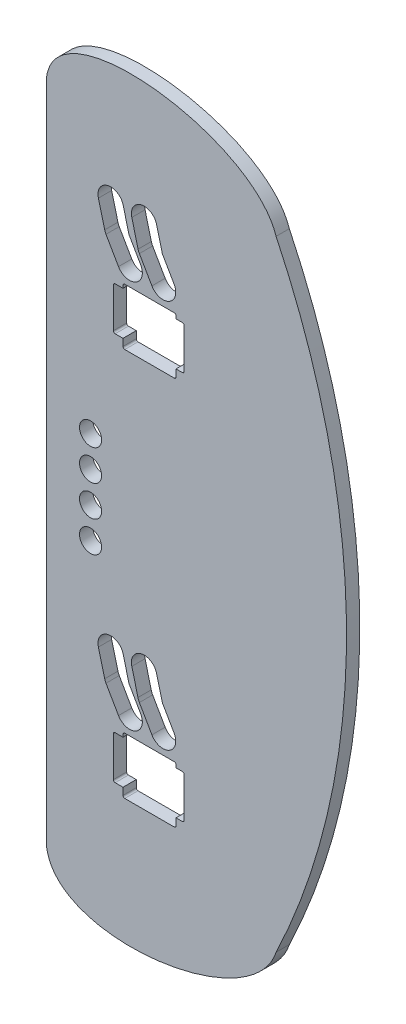
from build123d import *

# Parameters (mm, degrees)
SKETCH19_R          = 15.875
BOSS_EXTRUDE2_DEPTH = 19.05


with BuildPart() as part:
    # Sketch19 → Boss-Extrude2 (new body)
    with BuildSketch(Plane.XY):
        with BuildLine():
            add(Edge.make_bspline(
                [(1691.296561672, 1918.177904127), (1656.762851887, 2023.18607917), (1371.325091688, 2058.930160841), (1361.096561672, 1948.863494174)],
                knots=[0, 0, 0, 0, 7.638294788, 7.638294788, 7.638294788, 7.638294788], degree=3))
            Line((1361.096561672, 1948.863494174), (1361.096561672, 996.363494174))
            add(Edge.make_bspline(
                [(1691.296561672, 1027.049084222), (1656.707719979, 922.059056278), (1371.325091688, 886.296827508), (1361.096561672, 996.363494174)],
                knots=[0, 0, 0, 0, 7.629784399, 7.629784399, 7.629784399, 7.629784399], degree=3))
            ThreePointArc((1691.296561672, 1027.049084222), (1792.519416014, 1472.613494174), (1691.296561672, 1918.177904127))
        make_face()
        with BuildLine():
            Line((1556.504865632, 1122.44241392), (1547.43077252, 1122.44241392))
            Line((1547.43077252, 1122.44241392), (1547.43077252, 1112.28241392))
            ThreePointArc((1547.43077252, 1112.28241392), (1546.686823744, 1110.486362696), (1544.89077252, 1109.74241392))
            Line((1544.89077252, 1109.74241392), (1473.77077252, 1109.74241392))
            ThreePointArc((1473.77077252, 1109.74241392), (1471.974721296, 1110.486362696), (1471.23077252, 1112.28241392))
            Line((1471.23077252, 1112.28241392), (1471.23077252, 1122.44241392))
            Line((1471.23077252, 1122.44241392), (1459.984865632, 1122.44241392))
            ThreePointArc((1459.984865632, 1122.44241392), (1458.188814408, 1123.186362696), (1457.444865632, 1124.98241392))
            Line((1457.444865632, 1124.98241392), (1457.444865632, 1182.13241392))
            ThreePointArc((1457.444865632, 1182.13241392), (1458.188814408, 1183.928465145), (1459.984865632, 1184.67241392))
            Line((1459.984865632, 1184.67241392), (1471.23077252, 1184.67241392))
            Line((1471.23077252, 1184.67241392), (1471.23077252, 1188.48241392))
            ThreePointArc((1471.23077252, 1188.48241392), (1471.974721296, 1190.278465145), (1473.77077252, 1191.02241392))
            Line((1473.77077252, 1191.02241392), (1544.89077252, 1191.02241392))
            ThreePointArc((1544.89077252, 1191.02241392), (1546.686823744, 1190.278465145), (1547.43077252, 1188.48241392))
            Line((1547.43077252, 1188.48241392), (1547.43077252, 1184.67241392))
            Line((1547.43077252, 1184.67241392), (1556.504865632, 1184.67241392))
            ThreePointArc((1556.504865632, 1184.67241392), (1558.300916856, 1183.928465145), (1559.044865632, 1182.13241392))
            Line((1559.044865632, 1182.13241392), (1559.044865632, 1124.98241392))
            ThreePointArc((1559.044865632, 1124.98241392), (1558.300916856, 1123.186362696), (1556.504865632, 1122.44241392))
        make_face(mode=Mode.SUBTRACT)
        with BuildLine():
            Line((1444.893065071, 1244.244623225), (1435.893057671, 1279.244553225))
            ThreePointArc((1435.893057671, 1279.244553225), (1449.094985702, 1301.58631231), (1471.436744787, 1288.384384279))
            Line((1471.436744787, 1288.384384279), (1479.734522372, 1256.115340295))
            ThreePointArc((1479.734522372, 1256.115340295), (1479.841246759, 1255.791962976), (1479.990269115, 1255.485768066))
            Line((1479.990269115, 1255.485768066), (1495.595800102, 1228.231937145))
            ThreePointArc((1495.595800102, 1228.231937145), (1496.589194493, 1226.682766417), (1497.422422708, 1225.041884612))
            ThreePointArc((1497.422422708, 1225.041884612), (1488.994111708, 1201.213784587), (1464.764130707, 1208.40564094))
            Line((1464.764130707, 1208.40564094), (1446.764069078, 1239.655616711))
            ThreePointArc((1446.764069078, 1239.655616711), (1445.672935755, 1241.886666839), (1444.893065071, 1244.244623225))
        make_face(mode=Mode.SUBTRACT)
        with Locations(Location((1424.596561672, 1405.938494174, 0), (0, 0, 180))):
            Circle(SKETCH19_R, mode=Mode.SUBTRACT)
        with Locations(Location((1424.596561672, 1450.388494174, 0), (0, 0, 180))):
            Circle(SKETCH19_R, mode=Mode.SUBTRACT)
        with BuildLine():
            Line((1527.986726026, 1255.506514787), (1544.56575997, 1226.723451874))
            ThreePointArc((1544.56575997, 1226.723451874), (1537.823790218, 1201.663704337), (1512.764042681, 1208.405674089))
            Line((1512.764042681, 1208.405674089), (1494.764045881, 1239.655687936))
            ThreePointArc((1494.764045881, 1239.655687936), (1493.802589185, 1241.576837352), (1493.072252129, 1243.597189262))
            ThreePointArc((1493.072252129, 1243.597189262), (1492.894588833, 1244.238723731), (1492.740311476, 1244.886280075))
            Line((1492.740311476, 1244.886280075), (1483.894581433, 1279.238653731))
            ThreePointArc((1483.894581433, 1279.238653731), (1497.09201275, 1301.585586702), (1519.436740684, 1288.384422355))
            Line((1519.436740684, 1288.384422355), (1527.727745028, 1256.141718681))
            ThreePointArc((1527.727745028, 1256.141718681), (1527.835693423, 1255.815333734), (1527.986726026, 1255.506514787))
        make_face(mode=Mode.SUBTRACT)
        with Locations(Location((1424.596561672, 1494.838494174, 0), (0, 0, 180))):
            Circle(SKETCH19_R, mode=Mode.SUBTRACT)
        with Locations(Location((1424.596561672, 1539.288494174, 0), (0, 0, 180))):
            Circle(SKETCH19_R, mode=Mode.SUBTRACT)
        with BuildLine():
            Line((1547.43077252, 1681.24241392), (1547.43077252, 1671.08241392))
            ThreePointArc((1547.43077252, 1671.08241392), (1546.686823744, 1669.286362696), (1544.89077252, 1668.54241392))
            Line((1544.89077252, 1668.54241392), (1473.77077252, 1668.54241392))
            ThreePointArc((1473.77077252, 1668.54241392), (1471.974721296, 1669.286362696), (1471.23077252, 1671.08241392))
            Line((1471.23077252, 1671.08241392), (1471.23077252, 1681.24241392))
            Line((1471.23077252, 1681.24241392), (1459.984865632, 1681.24241392))
            ThreePointArc((1459.984865632, 1681.24241392), (1458.188814408, 1681.986362696), (1457.444865632, 1683.78241392))
            Line((1457.444865632, 1683.78241392), (1457.444865632, 1740.93241392))
            ThreePointArc((1457.444865632, 1740.93241392), (1458.188814408, 1742.728465145), (1459.984865632, 1743.47241392))
            Line((1459.984865632, 1743.47241392), (1471.23077252, 1743.47241392))
            Line((1471.23077252, 1743.47241392), (1471.23077252, 1747.28241392))
            ThreePointArc((1471.23077252, 1747.28241392), (1471.974721296, 1749.078465145), (1473.77077252, 1749.82241392))
            Line((1473.77077252, 1749.82241392), (1544.89077252, 1749.82241392))
            ThreePointArc((1544.89077252, 1749.82241392), (1546.686823744, 1749.078465145), (1547.43077252, 1747.28241392))
            Line((1547.43077252, 1747.28241392), (1547.43077252, 1743.47241392))
            Line((1547.43077252, 1743.47241392), (1556.504865632, 1743.47241392))
            ThreePointArc((1556.504865632, 1743.47241392), (1558.300916856, 1742.728465145), (1559.044865632, 1740.93241392))
            Line((1559.044865632, 1740.93241392), (1559.044865632, 1683.78241392))
            ThreePointArc((1559.044865632, 1683.78241392), (1558.300916856, 1681.986362696), (1556.504865632, 1681.24241392))
            Line((1556.504865632, 1681.24241392), (1547.43077252, 1681.24241392))
        make_face(mode=Mode.SUBTRACT)
        with BuildLine():
            Line((1444.893131568, 1803.044661302), (1435.893124168, 1838.044591302))
            ThreePointArc((1435.893124168, 1838.044591302), (1449.095052199, 1860.386350386), (1471.436811284, 1847.184422355))
            Line((1471.436811284, 1847.184422355), (1479.727821657, 1814.941695236))
            ThreePointArc((1479.727821657, 1814.941695236), (1479.835768961, 1814.615312965), (1479.98679977, 1814.30649635))
            Line((1479.98679977, 1814.30649635), (1496.565772911, 1785.52338757))
            ThreePointArc((1496.565772911, 1785.52338757), (1489.823779303, 1760.463721825), (1464.764105889, 1767.205686923))
            Line((1464.764105889, 1767.205686923), (1446.764116481, 1798.455687936))
            ThreePointArc((1446.764116481, 1798.455687936), (1445.672995031, 1800.686722627), (1444.893131568, 1803.044661302))
        make_face(mode=Mode.SUBTRACT)
        with BuildLine():
            Line((1492.893060968, 1803.044661302), (1483.893053568, 1838.044591302))
            ThreePointArc((1483.893053568, 1838.044591302), (1497.094981599, 1860.386350386), (1519.436740684, 1847.184422355))
            Line((1519.436740684, 1847.184422355), (1527.727745028, 1814.941718681))
            ThreePointArc((1527.727745028, 1814.941718681), (1527.835693423, 1814.615333734), (1527.986726026, 1814.306514787))
            Line((1527.986726026, 1814.306514787), (1544.56575257, 1785.523464721))
            ThreePointArc((1544.56575257, 1785.523464721), (1537.823782818, 1760.463717184), (1512.764035281, 1767.205686936))
            Line((1512.764035281, 1767.205686936), (1494.764045881, 1798.455687936))
            ThreePointArc((1494.764045881, 1798.455687936), (1493.672924431, 1800.686722627), (1492.893060968, 1803.044661302))
        make_face(mode=Mode.SUBTRACT)
    extrude(amount=BOSS_EXTRUDE2_DEPTH)


solid = part.part
